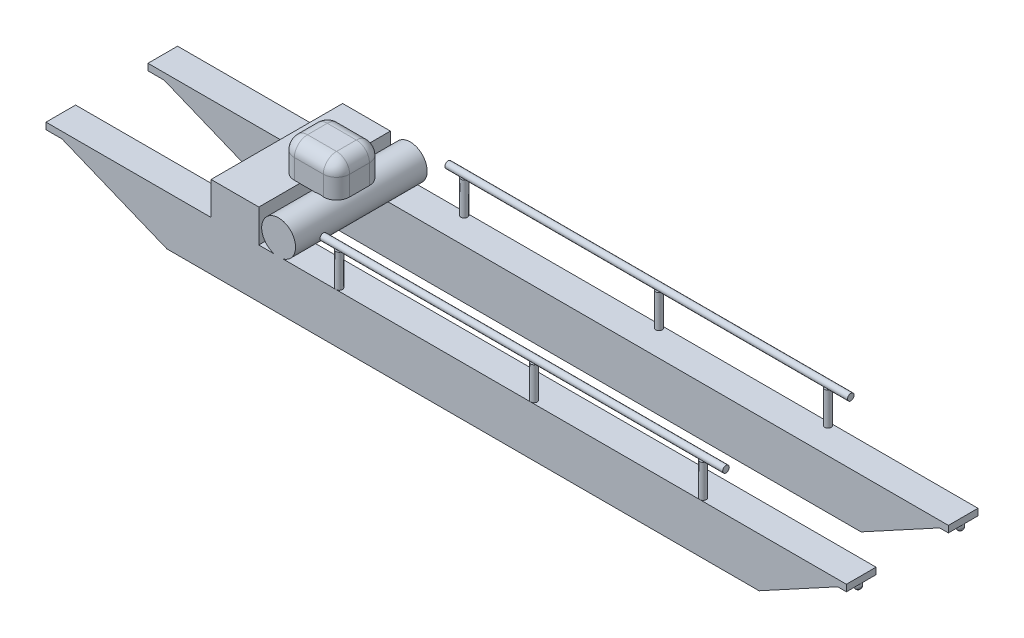
from build123d import *

# Parameters (mm, degrees)
SALIENTE_EXTRUIR1_DEPTH    = 900
CROQUIS3_R                 = 100
SALIENTE_EXTRUIR3_DEPTH    = 200
REDONDEO2_R                = 100
CROQUIS5_R                 = 100
SALIENTE_EXTRUIR4_DEPTH    = 200
REDONDEO4_R                = 100
SALIENTE_EXTRUIR5_DEPTH    = 3100
CROQUIS7_W                 = 24330
CROQUIS7_H                 = 2200
CORTAR_EXTRUIR1_DEPTH      = 3100
CROQUIS8_R                 = 100
SALIENTE_EXTRUIR6_DEPTH    = 200
REDONDEO5_R                = 100
CROQUIS9_W                 = 1452.210355606
CROQUIS9_H                 = 4000
SALIENTE_EXTRUIR7_DEPTH    = 1000
SALIENTE_EXTRUIR8_START    = -4000
CROQUIS10_R                = 515.420210515
SALIENTE_EXTRUIR8_DEPTH    = 4000
CROQUIS11_W                = 1680.611419081
CROQUIS11_H                = 1401.224066889
SALIENTE_EXTRUIR9_DEPTH    = 1000
REDONDEO6_R                = 400
CROQUIS12_R                = 100
SALIENTE_EXTRUIR10_DEPTH   = 1000
CROQUIS13_R                = 100
SALIENTE_EXTRUIR11_DEPTH   = 16000
SALIENTE_EXTRUIR11_2_DEPTH = 16000
CROQUIS14_W                = 3948.440701422
CROQUIS14_H                = 1335.33617589
CORTAR_EXTRUIR2_DEPTH      = 16000


with BuildPart() as part:
    # Croquis1 → Saliente-Extruir1 (new body)
    with BuildSketch(Plane.XY):
        Polygon((-12674.457000985, 0), (11655.542999015, 0), (11655.542999015, -200), (11389.988699114, -200), (9000, -1500), (0, -1500), (-9000, -1500), (-12184.529400853, -200), (-12674.457000985, -200), align=None)
    extrude(amount=SALIENTE_EXTRUIR1_DEPTH)

    # Croquis3 → Saliente-Extruir3 (add)
    with BuildSketch(Plane.XZ.offset(200)):
        with Locations((11555.542999015, 450)):
            Circle(CROQUIS3_R)
    extrude(amount=SALIENTE_EXTRUIR3_DEPTH)

    # Redondeo2
    redondeo2_edges = [part.edges().sort_by_distance(p)[0] for p in [
        (11455.542999015, -400, 450),
    ]]
    fillet(redondeo2_edges, radius=REDONDEO2_R)

    # Croquis5 → Saliente-Extruir4 (add)
    with BuildSketch(Plane.XZ.offset(200)):
        with Locations(Location((-12574.457000985, 450, 0), (0, 0, 180))):
            Circle(CROQUIS5_R)
    extrude(amount=SALIENTE_EXTRUIR4_DEPTH)

    # Redondeo4
    redondeo4_edges = [part.edges().sort_by_distance(p)[0] for p in [
        (-12474.457000985, -400, 450),
    ]]
    fillet(redondeo4_edges, radius=REDONDEO4_R)

    # Croquis6 → Saliente-Extruir5 (add)
    with BuildSketch(Plane.XY.offset(900)):
        Polygon((-12674.457000985, -200), (-12674.457000985, 0), (11655.542999015, 0), (11655.542999015, -200), (11389.988699114, -200), (9000, -1500), (-9000, -1500), (-12184.529400853, -200), align=None)
    extrude(amount=SALIENTE_EXTRUIR5_DEPTH)

    # Croquis7 → Cortar-Extruir1 (cut)
    with BuildSketch(Plane(origin=(0, 0, 0), x_dir=(1, 0, 0), z_dir=(0, 1, 0))):
        with Locations((-509.457000985, -2000)):
            Rectangle(CROQUIS7_W, CROQUIS7_H)
    extrude(amount=-CORTAR_EXTRUIR1_DEPTH, mode=Mode.SUBTRACT)


with BuildPart() as cortar_extruir1_piece_1:
    # of the separate pieces the step leaves, piece 1, a body of its own (cortar_extruir1_pieces)
    add(part.part.solids().sort_by_distance((-12674.457000985, -300, 450))[0])



with BuildPart() as cortar_extruir1_piece_2:
    # of the separate pieces the step leaves, piece 2, a body of its own (cortar_extruir1_pieces)
    add(part.part.solids().sort_by_distance((-12674.457000985, -200, 4000))[0])

    # Croquis8 → Saliente-Extruir6 (add)
    with BuildSketch(Plane.XZ.offset(200)):
        with Locations(Location((-12574.457000985, 3550, 0), (0, 0, 180))):
            Circle(CROQUIS8_R)
        with Locations((11555.542999015, 3550)):
            Circle(CROQUIS8_R)
    extrude(amount=SALIENTE_EXTRUIR6_DEPTH)

    # Redondeo5
    redondeo5_edges = [cortar_extruir1_piece_2.edges().sort_by_distance(p)[0] for p in [
        (11455.542999015, -400, 3550),
        (-12474.457000985, -400, 3550),
    ]]
    fillet(redondeo5_edges, radius=REDONDEO5_R)


with BuildPart() as cortar_extruir1_piece_1_1:
    add(cortar_extruir1_piece_1.part)

    add(cortar_extruir1_piece_2.part)  # Saliente-Extruir7 merges Cortar-Extruir1 piece 2
    # Croquis9 → Saliente-Extruir7 (add)
    with BuildSketch(Plane(origin=(0, 0, 0), x_dir=(1, 0, 0), z_dir=(0, 1, 0))):
        with Locations((-6931.119250737, -2000)):
            Rectangle(CROQUIS9_W, CROQUIS9_H)
    extrude(amount=SALIENTE_EXTRUIR7_DEPTH)

    # Croquis10 → Saliente-Extruir8 (add)
    with BuildSketch(Plane.XY.offset(4000).offset(SALIENTE_EXTRUIR8_START)):
        with Locations(Location((-5603.776469346, 500, 0), (0, 0, 284.050468551))):
            Circle(CROQUIS10_R)
    extrude(amount=SALIENTE_EXTRUIR8_DEPTH)

    # Croquis11 → Saliente-Extruir9 (add)
    with BuildSketch(Plane(origin=(0, 1000, 0), x_dir=(1, 0, 0), z_dir=(0, 1, 0))):
        with Locations((-5928.661968373, -2055.333940572)):
            Rectangle(CROQUIS11_W, CROQUIS11_H)
    extrude(amount=SALIENTE_EXTRUIR9_DEPTH)

    # Redondeo6
    redondeo6_edges = [cortar_extruir1_piece_1_1.edges().sort_by_distance(p)[0] for p in [
        (-6768.967677913, 2000, 2055.333940572),
        (-6768.967677913, 1500, 1354.721907127),
        (-5928.661968372, 2000, 2755.945974016),
        (-6768.967677913, 1500, 2755.945974016),
        (-5088.356258832, 2000, 2055.333940572),
        (-5088.356258832, 1500, 2755.945974016),
        (-5928.661968372, 2000, 1354.721907127),
        (-5088.356258832, 1500, 1354.721907127),
    ]]
    fillet(redondeo6_edges, radius=REDONDEO6_R)

    # Croquis12 → Saliente-Extruir10 (add)
    with BuildSketch(Plane(origin=(0, 0, 0), x_dir=(1, 0, 0), z_dir=(0, 1, 0))):
        with Locations(Location((-3862.965368931, -3900, 0), (0, 0, 270))):
            Circle(CROQUIS12_R)
        with Locations(Location((2059.975874674, -3900, 0), (0, 0, 270))):
            Circle(CROQUIS12_R)
        with Locations(Location((7198.265675863, -3900, 0), (0, 0, 270))):
            Circle(CROQUIS12_R)
        with Locations(Location((-3862.965368931, -100, 0), (0, 0, 90))):
            Circle(CROQUIS12_R)
        with Locations(Location((2059.975874674, -100, 0), (0, 0, 90))):
            Circle(CROQUIS12_R)
        with Locations(Location((7198.265675863, -100, 0), (0, 0, 90))):
            Circle(CROQUIS12_R)
    extrude(amount=SALIENTE_EXTRUIR10_DEPTH)


with BuildPart() as body_2:
    # Croquis13 → Saliente-Extruir11 (new body)
    with BuildSketch(Plane(origin=(11655.542999015, 0, 0), x_dir=(0, 0, -1), z_dir=(1, 0, 0))):
        with Locations((-3900, 1100)):
            Circle(CROQUIS13_R)
    extrude(amount=-SALIENTE_EXTRUIR11_DEPTH)


with BuildPart() as body_3:
    # Croquis13 → Saliente-Extruir11 2 (new body)
    with BuildSketch(Plane(origin=(11655.542999015, 0, 0), x_dir=(0, 0, -1), z_dir=(1, 0, 0))):
        with Locations((-104.575856154, 1100)):
            Circle(CROQUIS13_R)
    extrude(amount=-SALIENTE_EXTRUIR11_2_DEPTH)


with BuildPart() as cortar_extruir2_tool:
    # Croquis14 → Cortar-Extruir2 (new body)
    with BuildSketch(Plane.XY.offset(4000)):
        with Locations((9869.28192048, 1138.198915555)):
            Rectangle(CROQUIS14_W, CROQUIS14_H)
    extrude(amount=-CORTAR_EXTRUIR2_DEPTH)


with BuildPart() as body_2_1:
    add(body_2.part)

    # Cortar-Extruir2: cut by cortar_extruir2_tool
    add(cortar_extruir2_tool.part, mode=Mode.SUBTRACT)


with BuildPart() as body_3_1:
    add(body_3.part)

    # Cortar-Extruir2: cut by cortar_extruir2_tool
    add(cortar_extruir2_tool.part, mode=Mode.SUBTRACT)


solid = Compound([cortar_extruir1_piece_1_1.part, body_2_1.part, body_3_1.part])
